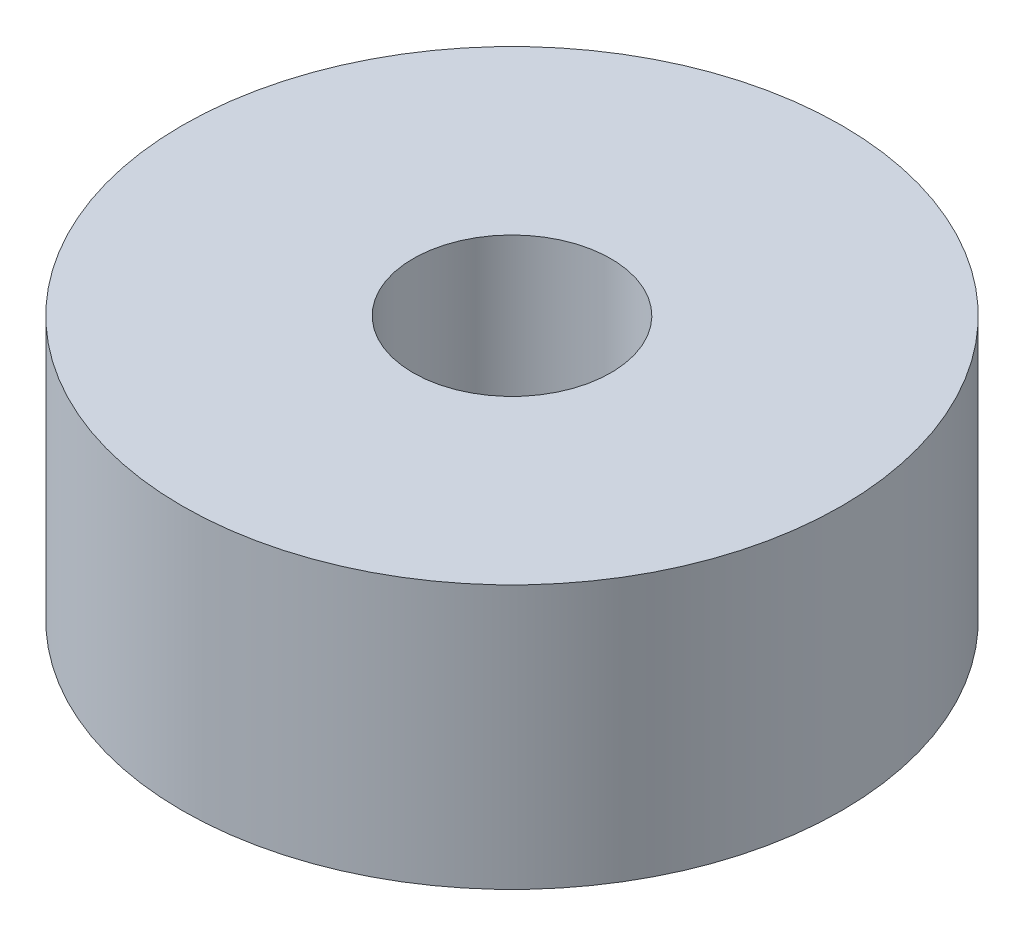
from build123d import *

# Parameters (mm, degrees)
SKETCH1_R           = 5
SKETCH1_R_2         = 1.5
BOSS_EXTRUDE1_DEPTH = 2


with BuildPart() as part:
    # Sketch1 → Boss-Extrude1 (new, symmetric)
    with BuildSketch(Plane(origin=(0, 0, 0), x_dir=(1, 0, 0), z_dir=(0, 1, 0))):
        with Locations(Location((0, 0, 0), (0, 0, 270))):
            Circle(SKETCH1_R)
        with Locations(Location((0, 0, 0), (0, 0, 270))):
            Circle(SKETCH1_R_2, mode=Mode.SUBTRACT)
    extrude(amount=BOSS_EXTRUDE1_DEPTH, both=True)


solid = part.part
